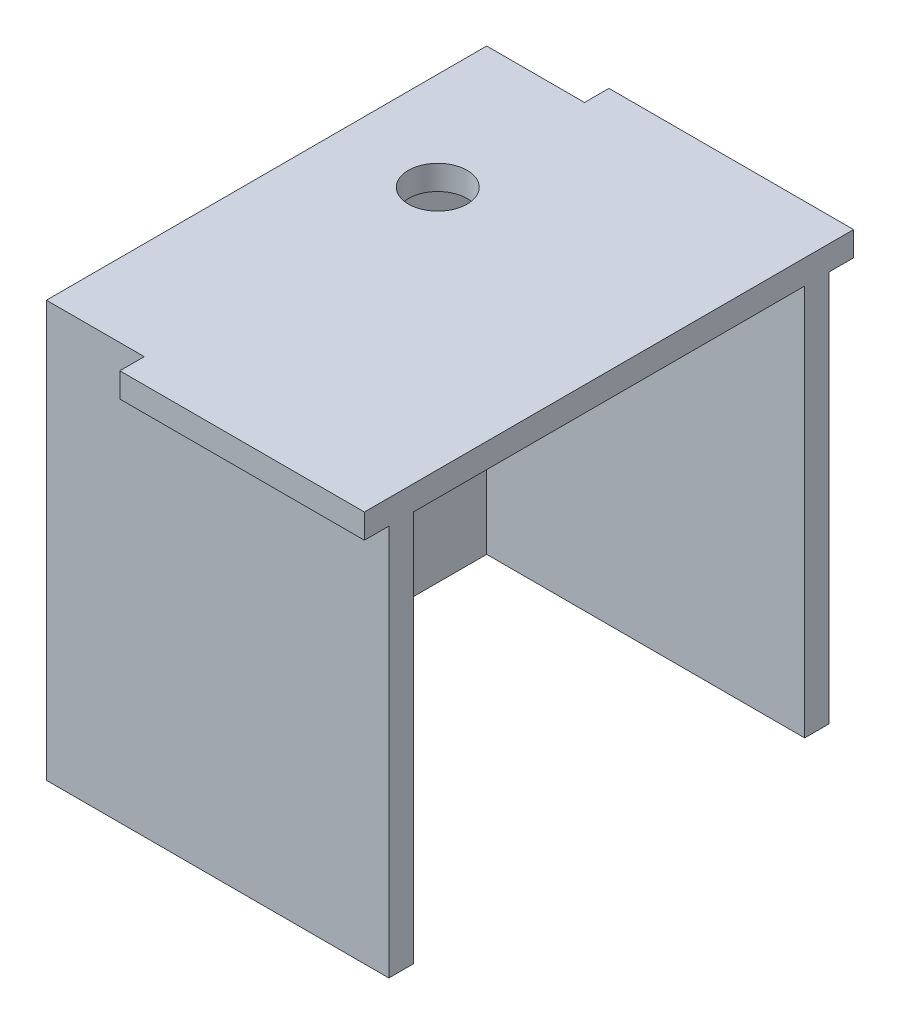
from build123d import *

# Parameters (mm, degrees)
BOSS_EXTRUDE1_DEPTH = 100
SKETCH2_W           = 5
SKETCH2_H           = 80
CUT_EXTRUDE2_DEPTH  = 5
SKETCH3_W           = 5
SKETCH3_H           = 80
CUT_EXTRUDE3_DEPTH  = 5
SKETCH4_W           = 15
SKETCH4_H           = 5
CUT_EXTRUDE4_DEPTH  = 5
SKETCH5_W           = 15
SKETCH5_H           = 5
CUT_EXTRUDE5_DEPTH  = 5
SKETCH6_R           = 1.5
CUT_EXTRUDE6_DEPTH  = 10
SKETCH7_W           = 66.05
SKETCH7_H           = 42.1
CUT_EXTRUDE7_DEPTH  = 10
SKETCH8_W           = 5
SKETCH8_H           = 20
BOSS_EXTRUDE2_DEPTH = 42.1
SKETCH10_R          = 6
CUT_EXTRUDE8_DEPTH  = 5
SKETCH11_W          = 5
SKETCH11_H          = 25
CUT_EXTRUDE9_DEPTH  = 100
SKETCH12_W          = 5
SKETCH12_H          = 5
CUT_EXTRUDE10_DEPTH = 5
SKETCH13_W          = 5
SKETCH13_H          = 5
CUT_EXTRUDE11_DEPTH = 5
SKETCH14_W          = 5
SKETCH14_H          = 80
BOSS_EXTRUDE3_DEPTH = 65


with BuildPart() as part:
    # Sketch1 → Boss-Extrude1 (new body)
    with BuildSketch(Plane.XY):
        Polygon((0, 0), (-65, 0), (-65, -80), (-70, -80), (-70, 0), (-70, 30), (-65, 30), (-65, 5), (0, 5), align=None)
    extrude(amount=BOSS_EXTRUDE1_DEPTH)

    # Sketch2 → Cut-Extrude2 (cut)
    with BuildSketch(Plane.XY.offset(100)):
        with Locations((-67.5, -40)):
            Rectangle(SKETCH2_W, SKETCH2_H)
    extrude(amount=-CUT_EXTRUDE2_DEPTH, mode=Mode.SUBTRACT)

    # Sketch3 → Cut-Extrude3 (cut)
    with BuildSketch(Plane(origin=(0, 0, 0), x_dir=(-1, 0, 0), z_dir=(0, 0, -1))):
        with Locations((67.5, -40)):
            Rectangle(SKETCH3_W, SKETCH3_H)
    extrude(amount=-CUT_EXTRUDE3_DEPTH, mode=Mode.SUBTRACT)

    # Sketch4 → Cut-Extrude4 (cut)
    with BuildSketch(Plane.XY.offset(100)):
        with Locations((-57.5, 2.5)):
            Rectangle(SKETCH4_W, SKETCH4_H)
    extrude(amount=-CUT_EXTRUDE4_DEPTH, mode=Mode.SUBTRACT)

    # Sketch5 → Cut-Extrude5 (cut)
    with BuildSketch(Plane(origin=(0, 0, 0), x_dir=(-1, 0, 0), z_dir=(0, 0, -1))):
        with Locations((57.5, 2.5)):
            Rectangle(SKETCH5_W, SKETCH5_H)
    extrude(amount=-CUT_EXTRUDE5_DEPTH, mode=Mode.SUBTRACT)

    # Sketch6 → Cut-Extrude6 (cut)
    with BuildSketch(Plane(origin=(-65, 0, 0), x_dir=(0, 0, -1), z_dir=(1, 0, 0))):
        with Locations((-50, -10)):
            Circle(SKETCH6_R)
        with Locations((-50, -60.45)):
            Circle(SKETCH6_R)
    extrude(amount=-CUT_EXTRUDE6_DEPTH, mode=Mode.SUBTRACT)

    # Sketch7 → Cut-Extrude7 (cut)
    with BuildSketch(Plane(origin=(-65, 0, 0), x_dir=(0, 0, -1), z_dir=(1, 0, 0))):
        with Locations((-61.975, -35.225)):
            Rectangle(SKETCH7_W, SKETCH7_H)
    extrude(amount=-CUT_EXTRUDE7_DEPTH, mode=Mode.SUBTRACT)

    # Sketch8 → Boss-Extrude2 (add)
    with BuildSketch(Plane.XZ.offset(14.175)):
        with Locations((-67.5, 85)):
            Rectangle(SKETCH8_W, SKETCH8_H)
    extrude(amount=BOSS_EXTRUDE2_DEPTH)

    # Sketch10 → Cut-Extrude8 (cut)
    with BuildSketch(Plane(origin=(0, 5, 0), x_dir=(1, 0, 0), z_dir=(0, 1, 0))):
        with Locations(Location((-50, -35, 0), (0, 0, 180))):
            Circle(SKETCH10_R)
    extrude(amount=-CUT_EXTRUDE8_DEPTH, mode=Mode.SUBTRACT)

    # Sketch11 → Cut-Extrude9 (cut)
    with BuildSketch(Plane.XY.offset(100)):
        with Locations((-67.5, 17.5)):
            Rectangle(SKETCH11_W, SKETCH11_H)
    extrude(amount=-CUT_EXTRUDE9_DEPTH, mode=Mode.SUBTRACT)

    # Sketch12 → Cut-Extrude10 (cut)
    with BuildSketch(Plane.XY.offset(100)):
        with Locations((-67.5, 2.5)):
            Rectangle(SKETCH12_W, SKETCH12_H)
    extrude(amount=-CUT_EXTRUDE10_DEPTH, mode=Mode.SUBTRACT)

    # Sketch13 → Cut-Extrude11 (cut)
    with BuildSketch(Plane(origin=(0, 0, 0), x_dir=(-1, 0, 0), z_dir=(0, 0, -1))):
        with Locations((67.5, 2.5)):
            Rectangle(SKETCH13_W, SKETCH13_H)
    extrude(amount=-CUT_EXTRUDE11_DEPTH, mode=Mode.SUBTRACT)

    # Sketch14 → Boss-Extrude3 (add)
    with BuildSketch(Plane(origin=(-65, 0, 0), x_dir=(0, 0, -1), z_dir=(1, 0, 0))):
        with Locations((-92.5, -40)):
            Rectangle(SKETCH14_W, SKETCH14_H)
        with Locations((-7.5, -40)):
            Rectangle(SKETCH14_W, SKETCH14_H)
    extrude(amount=BOSS_EXTRUDE3_DEPTH)


solid = part.part
